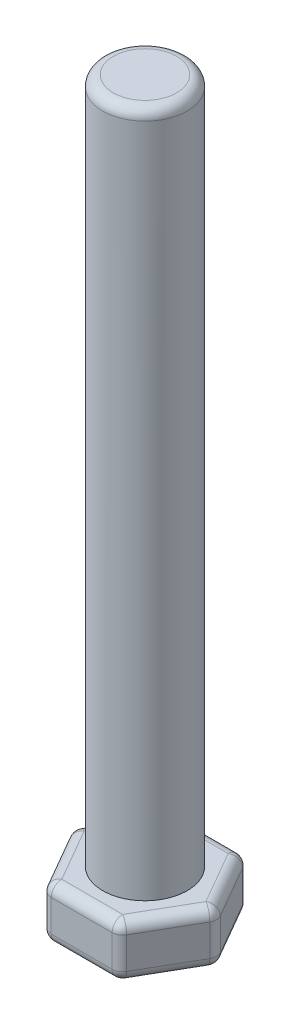
from build123d import *

# Parameters (mm, degrees)
SKETCH1_R           = 4
BOSS_EXTRUDE1_DEPTH = 65
BOSS_EXTRUDE2_DEPTH = 5
FILLET1_R           = 1
FILLET2_R           = 1


with BuildPart() as part:
    # Sketch1 → Boss-Extrude1 (new body)
    with BuildSketch(Plane(origin=(0, 0, 0), x_dir=(1, 0, 0), z_dir=(0, 1, 0))):
        with Locations(Location((0, 0, 0), (0, 0, 270))):
            Circle(SKETCH1_R)
    extrude(amount=BOSS_EXTRUDE1_DEPTH)

    # Sketch2 → Boss-Extrude2 (add)
    with BuildSketch(Plane.XZ):
        Polygon((-3.464101615, -6), (3.464101615, -6), (6.92820323, 0), (3.464101615, 6), (-3.464101615, 6), (-6.92820323, 0), align=None)
    extrude(amount=BOSS_EXTRUDE2_DEPTH)

    # Fillet1
    fillet1_edges = [part.edges().sort_by_distance(p)[0] for p in [
        (0, 65, -4),
    ]]
    fillet(fillet1_edges, radius=FILLET1_R)

    # Fillet2
    fillet2_edges = [part.edges().sort_by_distance(p)[0] for p in [
        (-5.196152423, 0, -3),
        (-6.92820323, -2.5, 0),
        (0, 0, -6),
        (-3.464101615, -2.5, -6),
        (5.196152423, 0, -3),
        (3.464101615, -2.5, -6),
        (5.196152423, 0, 3),
        (6.92820323, -2.5, 0),
        (0, 0, 6),
        (3.464101615, -2.5, 6),
        (-5.196152423, 0, 3),
        (-3.464101615, -2.5, 6),
        (-5.196152423, -5, -3),
        (0, -5, -6),
        (5.196152423, -5, -3),
        (5.196152423, -5, 3),
        (0, -5, 6),
        (-5.196152423, -5, 3),
    ]]
    fillet(fillet2_edges, radius=FILLET2_R)


solid = part.part
